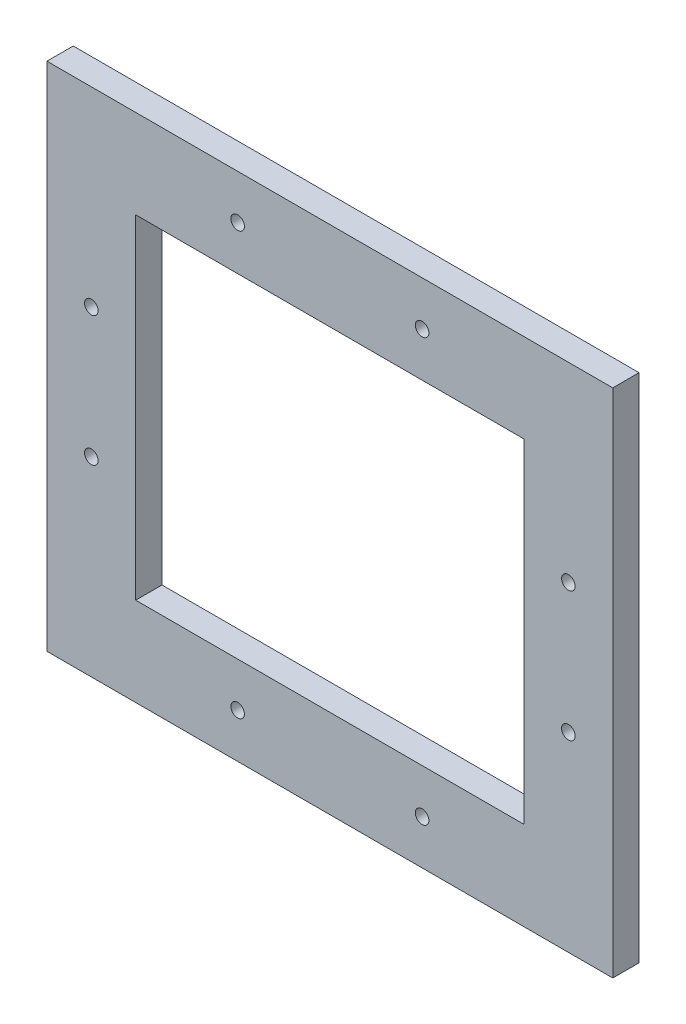
from build123d import *

# Parameters (mm, degrees)
SKETCH_1_W          = 129.17
SKETCH_1_H          = 116.67
SKETCH_1_W_2        = 88.65
SKETCH_1_H_2        = 76.19
EXTRUDE_1_DEPTH     = 6
SKETCH_2_R          = 1.55
CUT_EXTRUDE_1_DEPTH = 115.383560689


with BuildPart() as part:
    # Эскиз1 → Бобышка-Вытянуть1 (new body)
    with BuildSketch(Plane.XY):
        with Locations((7.986729107, -29.874654179)):
            Rectangle(SKETCH_1_W, SKETCH_1_H)
        with Locations((7.986729107, -29.874654179)):
            Rectangle(SKETCH_1_W_2, SKETCH_1_H_2, mode=Mode.SUBTRACT)
    extrude(amount=EXTRUDE_1_DEPTH)

    # Эскиз2 → Вырез-Вытянуть1 (cut, through all)
    with BuildSketch(Plane(origin=(0, 0, 0), x_dir=(-1, 0, 0), z_dir=(0, 0, -1))):
        with Locations((46.464144791, -15.068841065)):
            Circle(SKETCH_2_R)
        with Locations((46.464144791, -44.679267292)):
            Circle(SKETCH_2_R)
        with Locations((13.069084007, -78.074328076)):
            Circle(SKETCH_2_R)
        with Locations((-29.04134222, -78.074328076)):
            Circle(SKETCH_2_R)
        with Locations((-62.436403004, -44.679267292)):
            Circle(SKETCH_2_R)
        with Locations((-62.436403004, -15.068841065)):
            Circle(SKETCH_2_R)
        with Locations((-29.04134222, 18.326219719)):
            Circle(SKETCH_2_R)
        with Locations((13.069084007, 18.326219719)):
            Circle(SKETCH_2_R)
    extrude(amount=-CUT_EXTRUDE_1_DEPTH, mode=Mode.SUBTRACT)


solid = part.part
